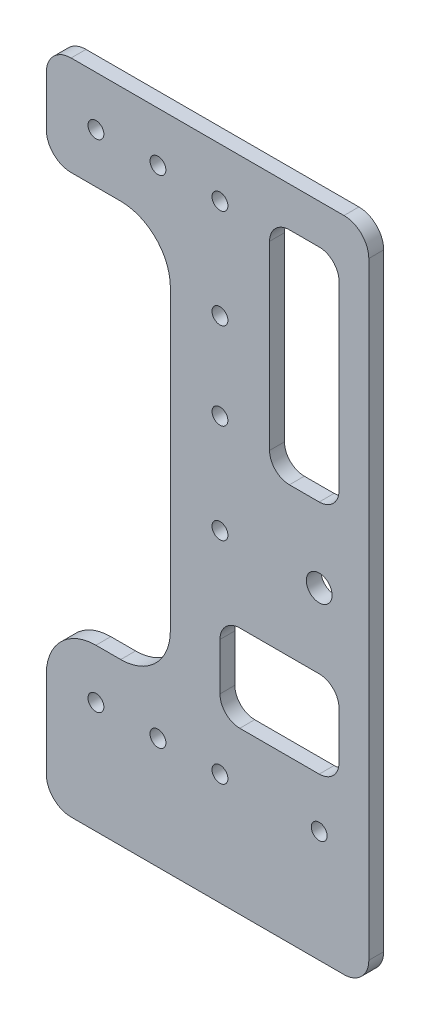
from build123d import *

# Parameters (mm, degrees)
SKETCH_1_R      = 2.6
SKETCH_1_R_2    = 1.6
EXTRUDE_1_DEPTH = 3


with BuildPart() as part:
    # 草图1 → 凸台-拉伸1 (new body)
    with BuildSketch(Plane.XY):
        with BuildLine():
            Line((-60, 77.5), (-5, 77.5))
            ThreePointArc((-5, 77.5), (-1.464466094, 76.035533906), (0, 72.5))
            Line((0, 72.5), (0, -50))
            ThreePointArc((0, -50), (-1.464466094, -53.535533906), (-5, -55))
            Line((-5, -55), (-60, -55))
            ThreePointArc((-60, -55), (-63.535533906, -53.535533906), (-65, -50))
            Line((-65, -50), (-65, -32.5))
            ThreePointArc((-65, -32.5), (-62.071067812, -25.428932188), (-55, -22.5))
            Line((-55, -22.5), (-50, -22.5))
            ThreePointArc((-50, -22.5), (-42.928932188, -19.571067812), (-40, -12.5))
            Line((-40, -12.5), (-40, 47.5))
            ThreePointArc((-40, 47.5), (-42.928932188, 54.571067812), (-50, 57.5))
            Line((-50, 57.5), (-60, 57.5))
            ThreePointArc((-60, 57.5), (-63.535533906, 58.964466094), (-65, 62.5))
            Line((-65, 62.5), (-65, 72.5))
            ThreePointArc((-65, 72.5), (-63.535533906, 76.035533906), (-60, 77.5))
        make_face()
        with Locations((-10, 10)):
            Circle(SKETCH_1_R, mode=Mode.SUBTRACT)
        with Locations((-55, 67.5)):
            Circle(SKETCH_1_R_2, mode=Mode.SUBTRACT)
        with Locations((-30, 10)):
            Circle(SKETCH_1_R_2, mode=Mode.SUBTRACT)
        with Locations((-30, 67.5)):
            Circle(SKETCH_1_R_2, mode=Mode.SUBTRACT)
        with Locations((-42.5, 67.5)):
            Circle(SKETCH_1_R_2, mode=Mode.SUBTRACT)
        with Locations((-30, 47.5)):
            Circle(SKETCH_1_R_2, mode=Mode.SUBTRACT)
        with Locations((-30, 30)):
            Circle(SKETCH_1_R_2, mode=Mode.SUBTRACT)
        with Locations((-55, -32.5)):
            Circle(SKETCH_1_R_2, mode=Mode.SUBTRACT)
        with Locations((-42.5, -32.5)):
            Circle(SKETCH_1_R_2, mode=Mode.SUBTRACT)
        with Locations((-30, -32.5)):
            Circle(SKETCH_1_R_2, mode=Mode.SUBTRACT)
        with Locations((-10, -32.5)):
            Circle(SKETCH_1_R_2, mode=Mode.SUBTRACT)
        with BuildLine():
            Line((-26, -5), (-10, -5))
            ThreePointArc((-10, -5), (-7.171572875, -6.171572875), (-6, -9))
            Line((-6, -9), (-6, -18.5))
            ThreePointArc((-6, -18.5), (-7.171572875, -21.328427125), (-10, -22.5))
            Line((-10, -22.5), (-26, -22.5))
            ThreePointArc((-26, -22.5), (-28.828427125, -21.328427125), (-30, -18.5))
            Line((-30, -18.5), (-30, -9))
            ThreePointArc((-30, -9), (-28.828427125, -6.171572875), (-26, -5))
        make_face(mode=Mode.SUBTRACT)
        with BuildLine():
            Line((-10, 25), (-16, 25))
            ThreePointArc((-16, 25), (-18.828427125, 26.171572875), (-20, 29))
            Line((-20, 29), (-20, 65.5))
            ThreePointArc((-20, 65.5), (-18.828427125, 68.328427125), (-16, 69.5))
            Line((-16, 69.5), (-10, 69.5))
            ThreePointArc((-10, 69.5), (-7.171572875, 68.328427125), (-6, 65.5))
            Line((-6, 65.5), (-6, 29))
            ThreePointArc((-6, 29), (-7.171572875, 26.171572875), (-10, 25))
        make_face(mode=Mode.SUBTRACT)
    extrude(amount=EXTRUDE_1_DEPTH)


solid = part.part
